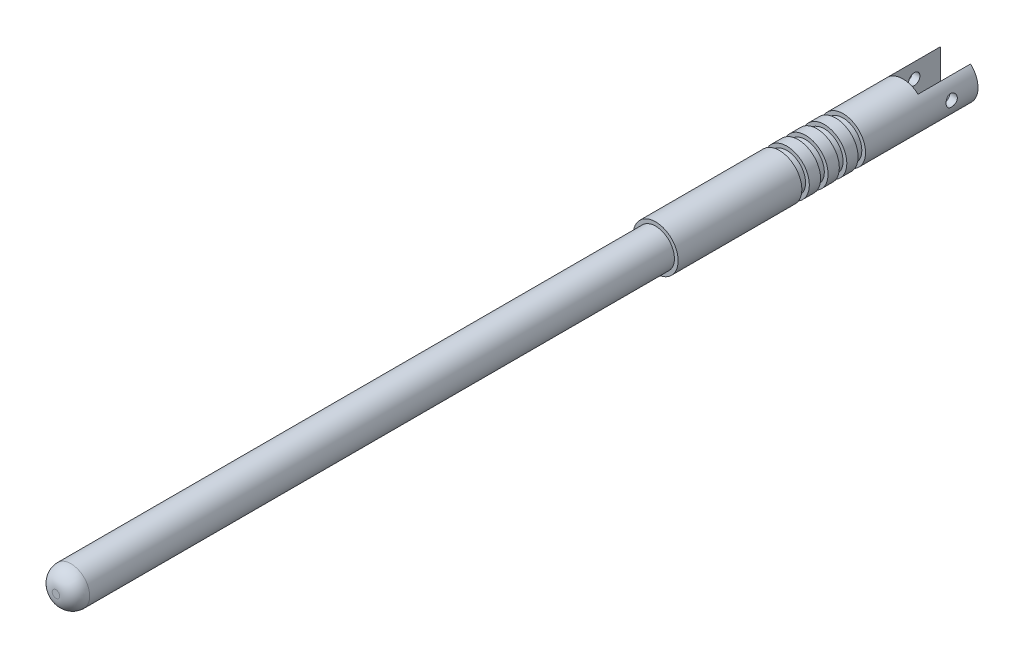
from build123d import *

# Parameters (mm, degrees)
SKETCH2_R               = 3
BOSS_EXTRUDE1_DEPTH     = 15
SKETCH3_W               = 4
SKETCH3_H               = 5.183202584
CUT_EXTRUDE1_DEPTH      = 7
CUT_EXTRUDE4_DEPTH      = 6
CUT_EXTRUDE4_DEPTH_BACK = 3
SKETCH4_R               = 0.75
SKETCH12_R              = 2.5
BOSS_EXTRUDE2_DEPTH     = 1
SKETCH13_R              = 3
BOSS_EXTRUDE3_DEPTH     = 1.5
SKETCH14_R              = 2.5
BOSS_EXTRUDE4_DEPTH     = 1
SKETCH15_R              = 3
BOSS_EXTRUDE5_DEPTH     = 1.5
SKETCH16_R              = 2.5
BOSS_EXTRUDE6_DEPTH     = 1
SKETCH17_R              = 3
BOSS_EXTRUDE7_DEPTH     = 1.5
SKETCH18_R              = 2.5
BOSS_EXTRUDE8_DEPTH     = 1
SKETCH19_R              = 3
BOSS_EXTRUDE9_DEPTH     = 16.5
SKETCH28_R              = 2.5
BOSS_EXTRUDE11_DEPTH    = 80
FILLET6_R               = 2


with BuildPart() as part:
    # Sketch2 → Boss-Extrude1 (new body)
    with BuildSketch(Plane.XY):
        Circle(SKETCH2_R)
    extrude(amount=BOSS_EXTRUDE1_DEPTH)

    # Sketch3 → Cut-Extrude1 (cut)
    with BuildSketch(Plane(origin=(0, 0, 0), x_dir=(-1, 0, 0), z_dir=(0, 0, -1))):
        with Locations((0, 0.591601292)):
            Rectangle(SKETCH3_W, SKETCH3_H)
    extrude(amount=-CUT_EXTRUDE1_DEPTH, mode=Mode.SUBTRACT)

    # Sketch4 → Cut-Extrude4 (cut, two sides: drawn at the far end of the back side and taken through both)
    with BuildSketch(Plane(origin=(-2, 0, 0), x_dir=(0, 0, -1), z_dir=(1, 0, 0)).offset(-CUT_EXTRUDE4_DEPTH_BACK)):
        with Locations((-3.5, 0.236067977)):
            Circle(SKETCH4_R)
    extrude(amount=CUT_EXTRUDE4_DEPTH + CUT_EXTRUDE4_DEPTH_BACK, mode=Mode.SUBTRACT)

    # Sketch12 → Boss-Extrude2 (add)
    with BuildSketch(Plane.XY.offset(15)):
        Circle(SKETCH12_R)
    extrude(amount=BOSS_EXTRUDE2_DEPTH)

    # Sketch13 → Boss-Extrude3 (add)
    with BuildSketch(Plane.XY.offset(16)):
        with Locations(Location((0, 0, 0), (0, 0, 131.810314896))):
            Circle(SKETCH13_R)
    extrude(amount=BOSS_EXTRUDE3_DEPTH)

    # Sketch14 → Boss-Extrude4 (add)
    with BuildSketch(Plane.XY.offset(17.5)):
        Circle(SKETCH14_R)
    extrude(amount=BOSS_EXTRUDE4_DEPTH)

    # Sketch15 → Boss-Extrude5 (add)
    with BuildSketch(Plane.XY.offset(18.5)):
        with Locations(Location((0, 0, 0), (0, 0, 131.810314896))):
            Circle(SKETCH15_R)
    extrude(amount=BOSS_EXTRUDE5_DEPTH)

    # Sketch16 → Boss-Extrude6 (add)
    with BuildSketch(Plane.XY.offset(20)):
        Circle(SKETCH16_R)
    extrude(amount=BOSS_EXTRUDE6_DEPTH)

    # Sketch17 → Boss-Extrude7 (add)
    with BuildSketch(Plane.XY.offset(21)):
        with Locations(Location((0, 0, 0), (0, 0, 131.810314896))):
            Circle(SKETCH17_R)
    extrude(amount=BOSS_EXTRUDE7_DEPTH)

    # Sketch18 → Boss-Extrude8 (add)
    with BuildSketch(Plane.XY.offset(22.5)):
        Circle(SKETCH18_R)
    extrude(amount=BOSS_EXTRUDE8_DEPTH)

    # Sketch19 → Boss-Extrude9 (add)
    with BuildSketch(Plane.XY.offset(23.5)):
        with Locations(Location((0, 0, 0), (0, 0, 131.810314896))):
            Circle(SKETCH19_R)
    extrude(amount=BOSS_EXTRUDE9_DEPTH)

    # Sketch28 → Boss-Extrude11 (add)
    with BuildSketch(Plane.XY.offset(40)):
        Circle(SKETCH28_R)
    extrude(amount=BOSS_EXTRUDE11_DEPTH)

    # Fillet6
    fillet6_edges = [part.edges().sort_by_distance(p)[0] for p in [
        (-2.5, 0, 120),
    ]]
    fillet(fillet6_edges, radius=FILLET6_R)


solid = part.part
